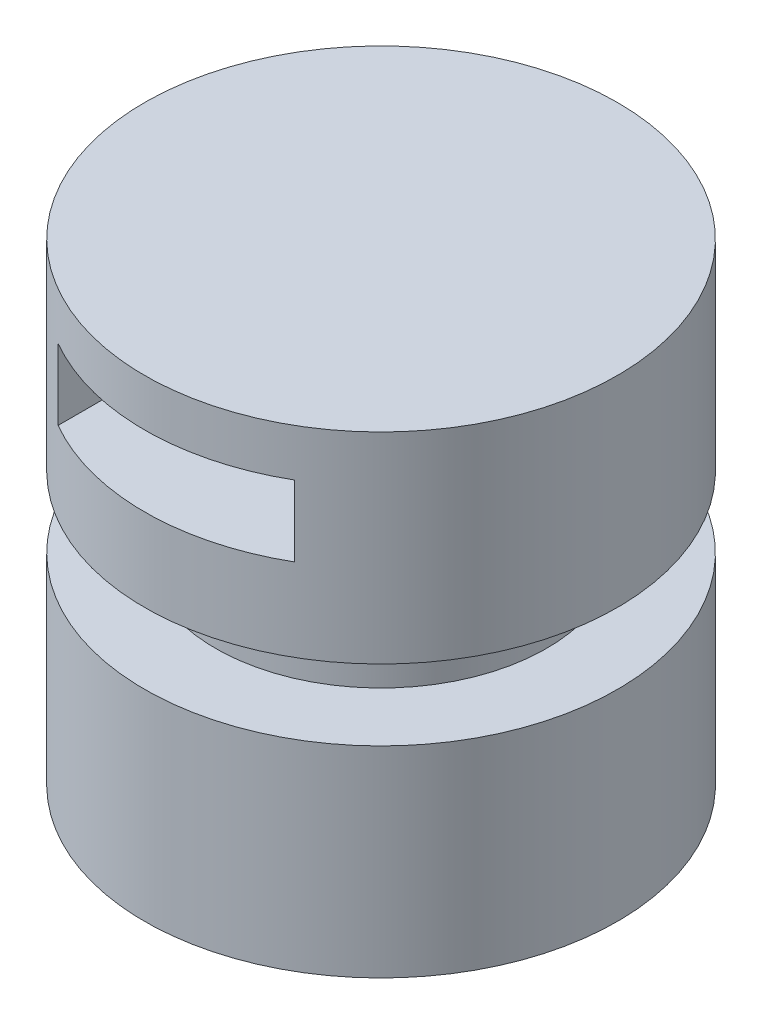
from build123d import *

# Parameters (mm, degrees)
SKETCH2_W               = 2540
SKETCH2_H               = 5080
SKETCH3_W               = 762
SKETCH3_H               = 762
SKETCH3_2_W             = 762
SKETCH3_2_H             = 762
CUT_EXTRUDE1_DEPTH      = 6222.703946669
CUT_EXTRUDE1_DEPTH_BACK = 6222.703946669
SKETCH4_W               = 2540
SKETCH4_H               = 762


with BuildPart() as part:
    # Sketch2 → Revolve2 (revolve)
    with BuildSketch(Plane.XY):
        with Locations((1270, 2540)):
            Rectangle(SKETCH2_W, SKETCH2_H)
    revolve(axis=Axis((0, 0, 0), (0, 1, 0)))

    # Sketch3 → Revolve3 (revolve)
    with BuildSketch(Plane(origin=(0, 0, 0), x_dir=(0, 0, -1), z_dir=(1, 0, 0))):
        with Locations((2159, 2540)):
            Rectangle(SKETCH3_W, SKETCH3_H)
    revolve(axis=Axis((0, 0, 0), (0, 1, 0)))

    # Sketch3<2> → Cut-Revolve1 (revolve, cut)
    with BuildSketch(Plane(origin=(0, 0, 0), x_dir=(0, 0, -1), z_dir=(1, 0, 0))):
        with Locations((2159, 2540)):
            Rectangle(SKETCH3_2_W, SKETCH3_2_H)
    revolve(axis=Axis((0, 0, 0), (0, 1, 0)), mode=Mode.SUBTRACT)

    # Sketch4 → Cut-Extrude1 (cut, two sides: drawn at the far end of the back side and taken through both)
    with BuildSketch(Plane.XY.offset(-CUT_EXTRUDE1_DEPTH_BACK)):
        with Locations((0, 4191)):
            Rectangle(SKETCH4_W, SKETCH4_H)
    extrude(amount=CUT_EXTRUDE1_DEPTH + CUT_EXTRUDE1_DEPTH_BACK, mode=Mode.SUBTRACT)


solid = part.part
